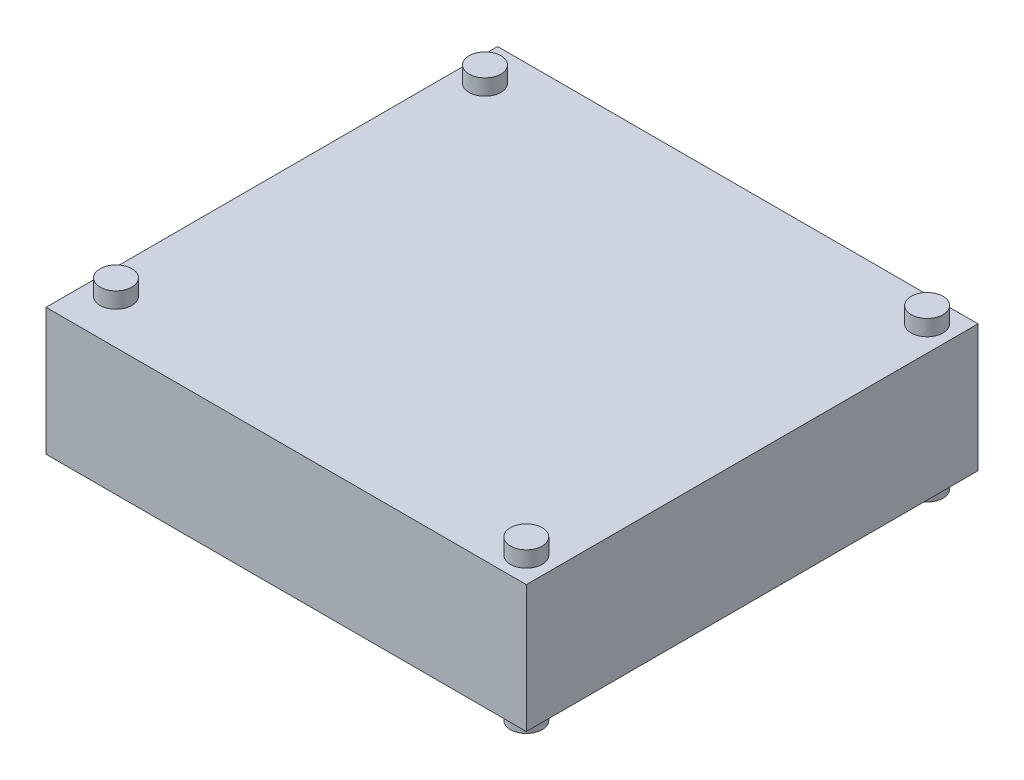
from build123d import *

# Parameters (mm, degrees)
SKETCH1_W                = 95.885
SKETCH1_H                = 90.17
SKETCH1_R                = 3.175
BOSS_EXTRUDE1_DEPTH      = 25.4
BOSS_EXTRUDE2_DEPTH      = 28.575
BOSS_EXTRUDE2_DEPTH_BACK = 3.175
SKETCH1_2_R              = 3.175


with BuildPart() as part:
    # Sketch1 → Boss-Extrude1 (new body)
    with BuildSketch(Plane(origin=(0, 0, 0), x_dir=(1, 0, 0), z_dir=(0, 1, 0))):
        Rectangle(SKETCH1_W, SKETCH1_H)
        with Locations((-42.8625, 37.465)):
            Circle(SKETCH1_R, mode=Mode.SUBTRACT)
        with Locations((-42.8625, -36.195)):
            Circle(SKETCH1_R, mode=Mode.SUBTRACT)
        with Locations((42.8625, 40.005)):
            Circle(SKETCH1_R, mode=Mode.SUBTRACT)
        with Locations((42.8625, -40.005)):
            Circle(SKETCH1_R, mode=Mode.SUBTRACT)
    extrude(amount=BOSS_EXTRUDE1_DEPTH)

    # Sketch1<2> → Boss-Extrude2 (add, two sides: drawn at the far end of the back side and taken through both)
    with BuildSketch(Plane(origin=(0, 0, 0), x_dir=(1, 0, 0), z_dir=(0, 1, 0)).offset(-BOSS_EXTRUDE2_DEPTH_BACK)):
        with Locations((-42.8625, 37.465)):
            Circle(SKETCH1_2_R)
        with Locations((-42.8625, -36.195)):
            Circle(SKETCH1_2_R)
        with Locations((42.8625, 40.005)):
            Circle(SKETCH1_2_R)
        with Locations((42.8625, -40.005)):
            Circle(SKETCH1_2_R)
    extrude(amount=BOSS_EXTRUDE2_DEPTH + BOSS_EXTRUDE2_DEPTH_BACK)


solid = part.part
